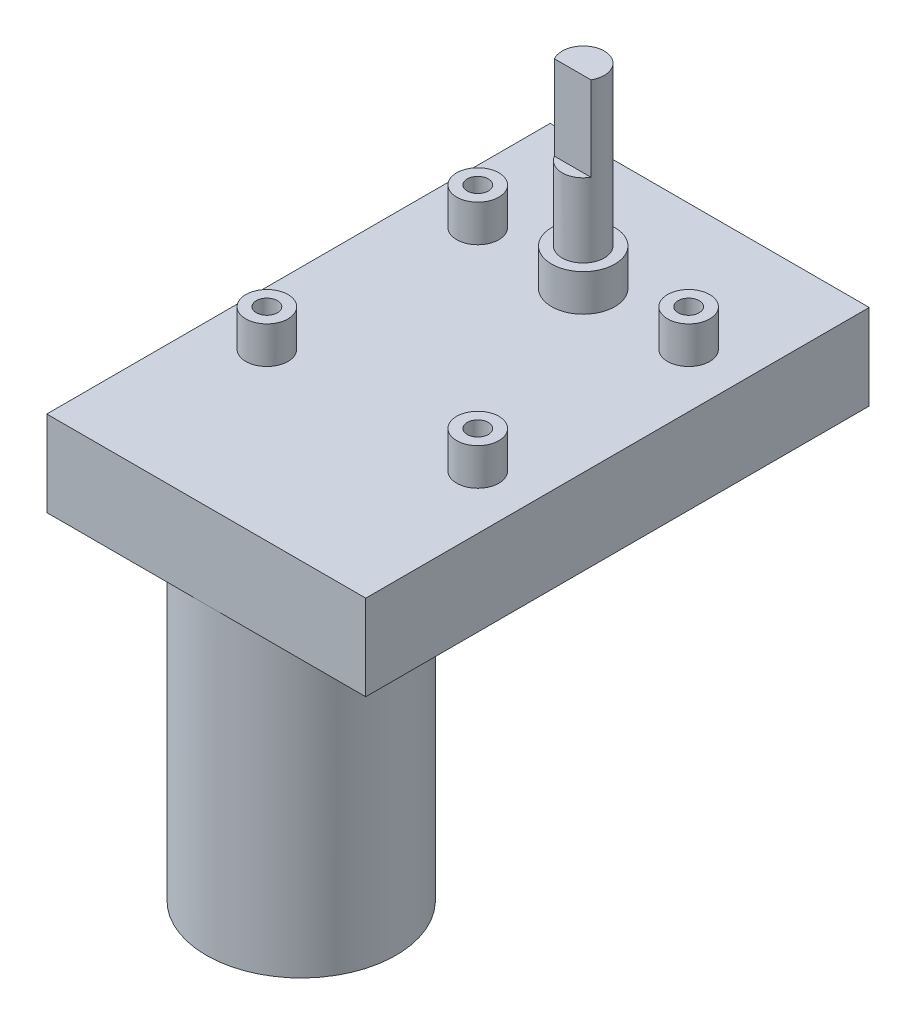
from build123d import *

# Parameters (mm, degrees)
SKETCH_1_W          = 60.5
SKETCH_1_H          = 95.5
EXTRUDE_1_DEPTH     = 16.2
SKETCH_2_R          = 6
SKETCH_2_R_2        = 4
SKETCH_2_R_3        = 2
EXTRUDE_2_DEPTH     = 7
SKETCH_3_R          = 4
EXTRUDE_3_DEPTH     = 30
CUT_EXTRUDE_START   = -16
CUT_EXTRUDE_1_DEPTH = 16
SKETCH_5_R          = 4
SKETCH_5_R_2        = 2
EXTRUDE_4_DEPTH     = 8
SKETCH_6_R          = 18
EXTRUDE_5_DEPTH     = 57.6


with BuildPart() as part:
    # 草图1 → 凸台-拉伸1 (new body)
    with BuildSketch(Plane(origin=(0, 0, 0), x_dir=(1, 0, 0), z_dir=(0, 1, 0))):
        with Locations((0, -23.75)):
            Rectangle(SKETCH_1_W, SKETCH_1_H)
    extrude(amount=EXTRUDE_1_DEPTH)

    # 草图2 → 凸台-拉伸2 (add)
    # profile 1 of 5: a face of its own
    with BuildSketch(Plane(origin=(0, 16.2, 0), x_dir=(1, 0, 0), z_dir=(0, 1, 0))):
        with Locations(Location((0, 0, 0), (0, 0, 90))):
            Circle(SKETCH_2_R)
    # profile 2 of 5: a face of its own
    with BuildSketch(Plane(origin=(0, 16.2, 0), x_dir=(1, 0, 0), z_dir=(0, 1, 0))):
        with Locations(Location((-20, 0, 0), (0, 0, 90))):
            Circle(SKETCH_2_R_2)
        with Locations(Location((-20, 0, 0), (0, 0, 270))):
            Circle(SKETCH_2_R_3, mode=Mode.SUBTRACT)
    # profile 3 of 5: a face of its own
    with BuildSketch(Plane(origin=(0, 16.2, 0), x_dir=(1, 0, 0), z_dir=(0, 1, 0))):
        with Locations(Location((20, 0, 0), (0, 0, 90))):
            Circle(SKETCH_2_R_2)
        with Locations(Location((20, 0, 0), (0, 0, 270))):
            Circle(SKETCH_2_R_3, mode=Mode.SUBTRACT)
    # profile 4 of 5: a face of its own
    with BuildSketch(Plane(origin=(0, 16.2, 0), x_dir=(1, 0, 0), z_dir=(0, 1, 0))):
        with Locations(Location((20, -40, 0), (0, 0, 90))):
            Circle(SKETCH_2_R_2)
        with Locations(Location((20, -40, 0), (0, 0, 270))):
            Circle(SKETCH_2_R_3, mode=Mode.SUBTRACT)
    # profile 5 of 5: a face of its own
    with BuildSketch(Plane(origin=(0, 16.2, 0), x_dir=(1, 0, 0), z_dir=(0, 1, 0))):
        with Locations(Location((-20, -40, 0), (0, 0, 90))):
            Circle(SKETCH_2_R_2)
        with Locations(Location((-20, -40, 0), (0, 0, 270))):
            Circle(SKETCH_2_R_3, mode=Mode.SUBTRACT)
    extrude(amount=EXTRUDE_2_DEPTH)

    # 草图3 → 凸台-拉伸3 (add)
    with BuildSketch(Plane(origin=(0, 23.2, 0), x_dir=(1, 0, 0), z_dir=(0, 1, 0))):
        with Locations(Location((0, 0, 0), (0, 0, 270))):
            Circle(SKETCH_3_R)
    extrude(amount=EXTRUDE_3_DEPTH)

    # 草图4 → 切除-拉伸1 (cut)
    with BuildSketch(Plane(origin=(0, 53.2, 0), x_dir=(1, 0, 0), z_dir=(0, 1, 0)).offset(CUT_EXTRUDE_START)):
        with BuildLine():
            Line((-3.464101615, -2), (3.464101615, -2))
            ThreePointArc((3.464101615, -2), (0, -4), (-3.464101615, -2))
        make_face()
    extrude(amount=CUT_EXTRUDE_1_DEPTH, mode=Mode.SUBTRACT)

    # 草图5 → 凸台-拉伸4 (add)
    # profile 1 of 4: a face of its own
    with BuildSketch(Plane(origin=(0, 0, 0), x_dir=(-1, 0, 0), z_dir=(0, -1, 0))):
        with Locations(Location((-17.5, 12.5, 0), (0, 0, 90))):
            Circle(SKETCH_5_R)
        with Locations(Location((-17.5, 12.5, 0), (0, 0, 90))):
            Circle(SKETCH_5_R_2, mode=Mode.SUBTRACT)
    # profile 2 of 4: a face of its own
    with BuildSketch(Plane(origin=(0, 0, 0), x_dir=(-1, 0, 0), z_dir=(0, -1, 0))):
        with Locations(Location((17.5, 12.5, 0), (0, 0, 90))):
            Circle(SKETCH_5_R)
        with Locations(Location((17.5, 12.5, 0), (0, 0, 90))):
            Circle(SKETCH_5_R_2, mode=Mode.SUBTRACT)
    # profile 3 of 4: a face of its own
    with BuildSketch(Plane(origin=(0, 0, 0), x_dir=(-1, 0, 0), z_dir=(0, -1, 0))):
        with Locations(Location((17.5, -12.5, 0), (0, 0, 90))):
            Circle(SKETCH_5_R)
        with Locations(Location((17.5, -12.5, 0), (0, 0, 90))):
            Circle(SKETCH_5_R_2, mode=Mode.SUBTRACT)
    # profile 4 of 4: a face of its own
    with BuildSketch(Plane(origin=(0, 0, 0), x_dir=(-1, 0, 0), z_dir=(0, -1, 0))):
        with Locations(Location((-17.5, -12.5, 0), (0, 0, 90))):
            Circle(SKETCH_5_R)
        with Locations(Location((-17.5, -12.5, 0), (0, 0, 90))):
            Circle(SKETCH_5_R_2, mode=Mode.SUBTRACT)
    extrude(amount=EXTRUDE_4_DEPTH)

    # 草图6 → 凸台-拉伸5 (add)
    with BuildSketch(Plane.XZ):
        with Locations(Location((0, 53.5, 0), (0, 0, 90))):
            Circle(SKETCH_6_R)
    extrude(amount=EXTRUDE_5_DEPTH)


solid = part.part
